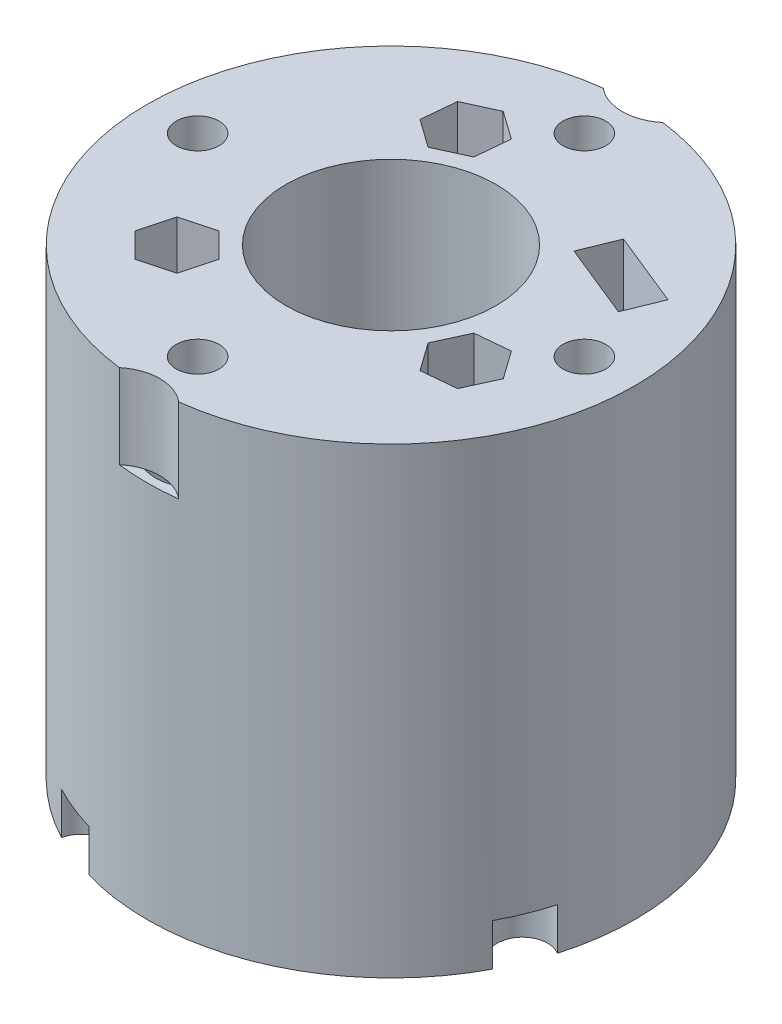
from build123d import *

# Parameters (mm, degrees)
SKETCH1_R           = 29
BOSS_EXTRUDE1_DEPTH = 55
SKETCH5_R           = 5
CUT_EXTRUDE2_DEPTH  = 45
SKETCH4_R           = 2.55
CUT_EXTRUDE1_DEPTH  = 69.607579756
CIRPATTERN2_COUNT   = 4
SKETCH6_R           = 12.5
CUT_EXTRUDE3_DEPTH  = 69.607579756
SKETCH8_R           = 3
CUT_EXTRUDE4_DEPTH  = 5
CUT_EXTRUDE5_DEPTH  = 1
CUT_EXTRUDE6_DEPTH  = 68.808554033
SKETCH12_R          = 3.9
CUT_EXTRUDE7_DEPTH  = 6
CUT_EXTRUDE8_DEPTH  = 45
SKETCH14_R          = 2.15
CUT_EXTRUDE9_DEPTH  = 69.607579756
SKETCH16_R          = 5.5
CUT_EXTRUDE10_DEPTH = 10


with BuildPart() as part:
    # Sketch1 → Boss-Extrude1 (new body)
    with BuildSketch(Plane(origin=(0, 0, 0), x_dir=(1, 0, 0), z_dir=(0, 1, 0))):
        with Locations(Location((0, 0, 0), (0, 0, 270))):
            Circle(SKETCH1_R)
    extrude(amount=BOSS_EXTRUDE1_DEPTH)

    # Sketch5 → Cut-Extrude2 (cut)
    with BuildSketch(Plane.XZ):
        with Locations(Location((-23, 0, 0), (0, 0, 270))):
            Circle(SKETCH5_R)
    cut_extrude2 = extrude(amount=-CUT_EXTRUDE2_DEPTH, mode=Mode.SUBTRACT)

    # Sketch4 → Cut-Extrude1 (cut, through all)
    with BuildSketch(Plane.XZ):
        with Locations(Location((-23, 0, 0), (0, 0, 270))):
            Circle(SKETCH4_R)
    cut_extrude1 = extrude(amount=-CUT_EXTRUDE1_DEPTH, mode=Mode.SUBTRACT)

    # CirPattern2: Cut-Extrude2, Cut-Extrude1 ×4 about axis
    cirpattern2_axis = Axis((0, 0, 0), (0, 1, 0))
    add([cut_extrude2.rotate(cirpattern2_axis, i * 360 / CIRPATTERN2_COUNT) for i in range(1, CIRPATTERN2_COUNT)], mode=Mode.SUBTRACT)
    add([cut_extrude1.rotate(cirpattern2_axis, i * 360 / CIRPATTERN2_COUNT) for i in range(1, CIRPATTERN2_COUNT)], mode=Mode.SUBTRACT)

    # Sketch6 → Cut-Extrude3 (cut, through all)
    with BuildSketch(Plane.XZ):
        with Locations(Location((0, 0, 0), (0, 0, 270))):
            Circle(SKETCH6_R)
    extrude(amount=-CUT_EXTRUDE3_DEPTH, mode=Mode.SUBTRACT)

    # Sketch8 → Cut-Extrude4 (cut)
    with BuildSketch(Plane.XZ):
        with Locations((-10.601366594, 26.239303084)):
            Circle(SKETCH8_R)
        with Locations((-26.239303084, -10.601366594)):
            Circle(SKETCH8_R)
        with Locations((10.601366594, -26.239303084)):
            Circle(SKETCH8_R)
        with Locations((26.239303084, 10.601366594)):
            Circle(SKETCH8_R)
    extrude(amount=-CUT_EXTRUDE4_DEPTH, mode=Mode.SUBTRACT)

    # Sketch9 → Cut-Extrude5 (cut)
    with BuildSketch(Plane.XZ):
        Polygon((20.610897481, -6.158537344), (22.597250544, -11.050653604), (12.998325456, -14.948119084), (11.011972394, -10.056002823), align=None)
    extrude(amount=-CUT_EXTRUDE5_DEPTH, mode=Mode.SUBTRACT)

    # Sketch11 → Cut-Extrude6 (cut, through all)
    with BuildSketch(Plane.XZ.offset(-1)):
        Polygon((22.102990836, -10.841856908), (20.402100785, -6.652797052), (11.506232102, -10.264799519), (13.207122153, -14.453859375), align=None)
    extrude(amount=-CUT_EXTRUDE6_DEPTH, mode=Mode.SUBTRACT)

    # Sketch12 → Cut-Extrude7 (cut)
    with BuildSketch(Plane.XZ):
        with Locations(Location((7.117525275, -17.616493237, 0), (0, 0, 270))):
            Circle(SKETCH12_R)
    extrude(amount=-CUT_EXTRUDE7_DEPTH, mode=Mode.SUBTRACT)

    # Sketch13 → Cut-Extrude8 (cut)
    with BuildSketch(Plane(origin=(0, 55, 0), x_dir=(1, 0, 0), z_dir=(0, 1, 0))):
        Polygon((18.745625864, -10.826118617), (20.450388629, -7.098234868), (18.074327983, -3.757925131), (13.993504571, -4.145499143), (12.288741806, -7.873382892), (14.664802452, -11.213692629), align=None)
        Polygon((-4.145499143, 13.993504571), (-3.757925131, 18.074327983), (-7.098234868, 20.450388629), (-10.826118617, 18.745625864), (-11.213692629, 14.664802452), (-7.873382892, 12.288741806), align=None)
        Polygon((-13.788869703, -16.687432566), (-9.829359199, -15.626484924), (-8.768411557, -11.666974419), (-11.666974419, -8.768411557), (-15.626484924, -9.829359199), (-16.687432566, -13.788869703), align=None)
    extrude(amount=-CUT_EXTRUDE8_DEPTH, mode=Mode.SUBTRACT)

    # Sketch14 → Cut-Extrude9 (cut, through all)
    with BuildSketch(Plane(origin=(0, 55, 0), x_dir=(1, 0, 0), z_dir=(0, 1, 0))):
        with Locations(Location((-7.48580888, 16.369565217, 0), (0, 0, 270))):
            Circle(SKETCH14_R)
        with Locations(Location((16.369565217, -7.48580888, 0), (0, 0, 270))):
            Circle(SKETCH14_R)
        with Locations(Location((-12.727922061, -12.727922061, 0), (0, 0, 270))):
            Circle(SKETCH14_R)
    extrude(amount=-CUT_EXTRUDE9_DEPTH, mode=Mode.SUBTRACT)

    # Sketch16 → Cut-Extrude10 (cut)
    with BuildSketch(Plane(origin=(0, 55, 0), x_dir=(1, 0, 0), z_dir=(0, 1, 0))):
        with Locations((0, 33)):
            Circle(SKETCH16_R)
        with Locations((0, -33)):
            Circle(SKETCH16_R)
    extrude(amount=-CUT_EXTRUDE10_DEPTH, mode=Mode.SUBTRACT)


solid = part.part
